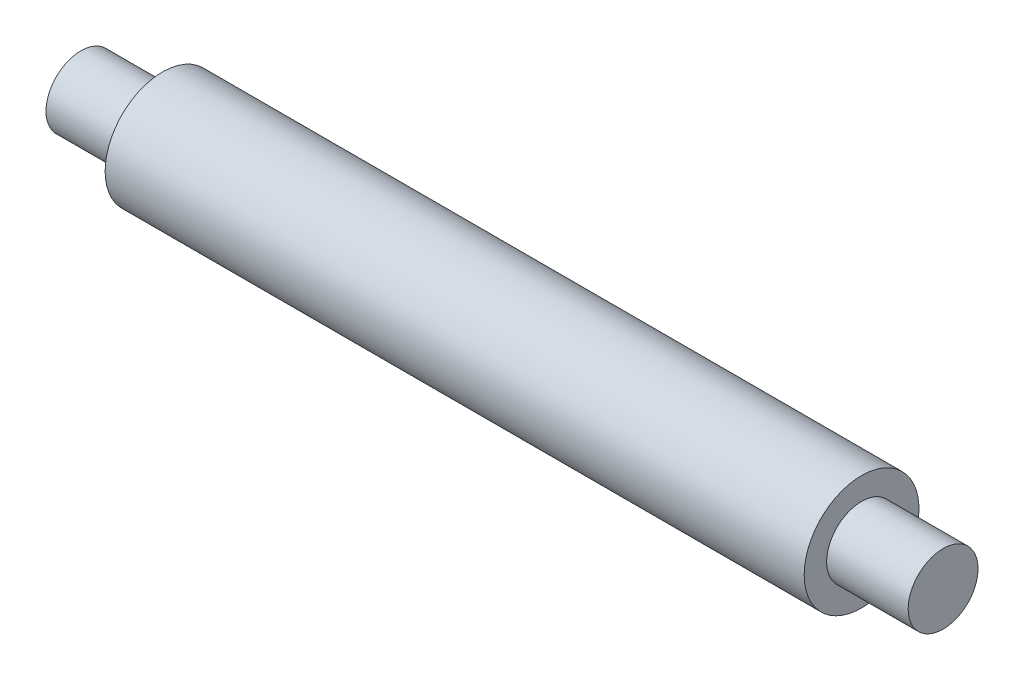
from build123d import *


with BuildPart() as part:
    # Sketch1 → Revolve1 (revolve)
    with BuildSketch(Plane.XY, mode=Mode.PRIVATE) as revolve1_sk:
        Polygon((0, 0), (30, 0), (37, 0), (37, 1.5), (33.5, 1.5), (33.5, 2.462549686), (3.5, 2.462549686), (3.5, 1.5), (0, 1.5), align=None)
    revolve(revolve1_sk.sketch.rotate(Axis((0, 0, 0), (1, 0, 0)), 90), axis=Axis((0, 0, 0), (1, 0, 0)))


solid = part.part
